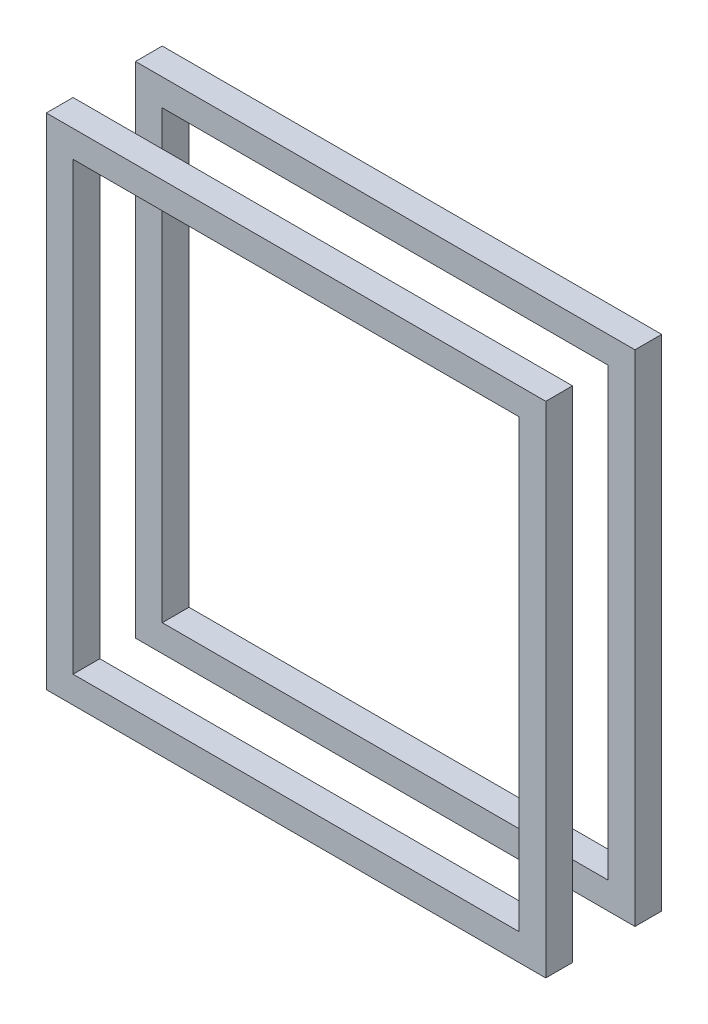
from build123d import *

# Parameters (mm, degrees)
SKETCH1_W           = 56
SKETCH1_H           = 56
SKETCH1_W_2         = 50
SKETCH1_H_2         = 50
BOSS_EXTRUDE1_DEPTH = 3
SKETCH2_W           = 56
SKETCH2_H           = 56
SKETCH2_W_2         = 50
SKETCH2_H_2         = 50
BOSS_EXTRUDE2_DEPTH = 3


with BuildPart() as part:
    # Sketch1 → Boss-Extrude1 (new body)
    with BuildSketch(Plane.XY):
        Rectangle(SKETCH1_W, SKETCH1_H)
        Rectangle(SKETCH1_W_2, SKETCH1_H_2, mode=Mode.SUBTRACT)
    extrude(amount=BOSS_EXTRUDE1_DEPTH)


with BuildPart() as body_2:
    # Sketch2 → Boss-Extrude2 (new body)
    with BuildSketch(Plane.XY.offset(-10)):
        Rectangle(SKETCH2_W, SKETCH2_H)
        Rectangle(SKETCH2_W_2, SKETCH2_H_2, mode=Mode.SUBTRACT)
    extrude(amount=BOSS_EXTRUDE2_DEPTH)


solid = Compound([part.part, body_2.part])
